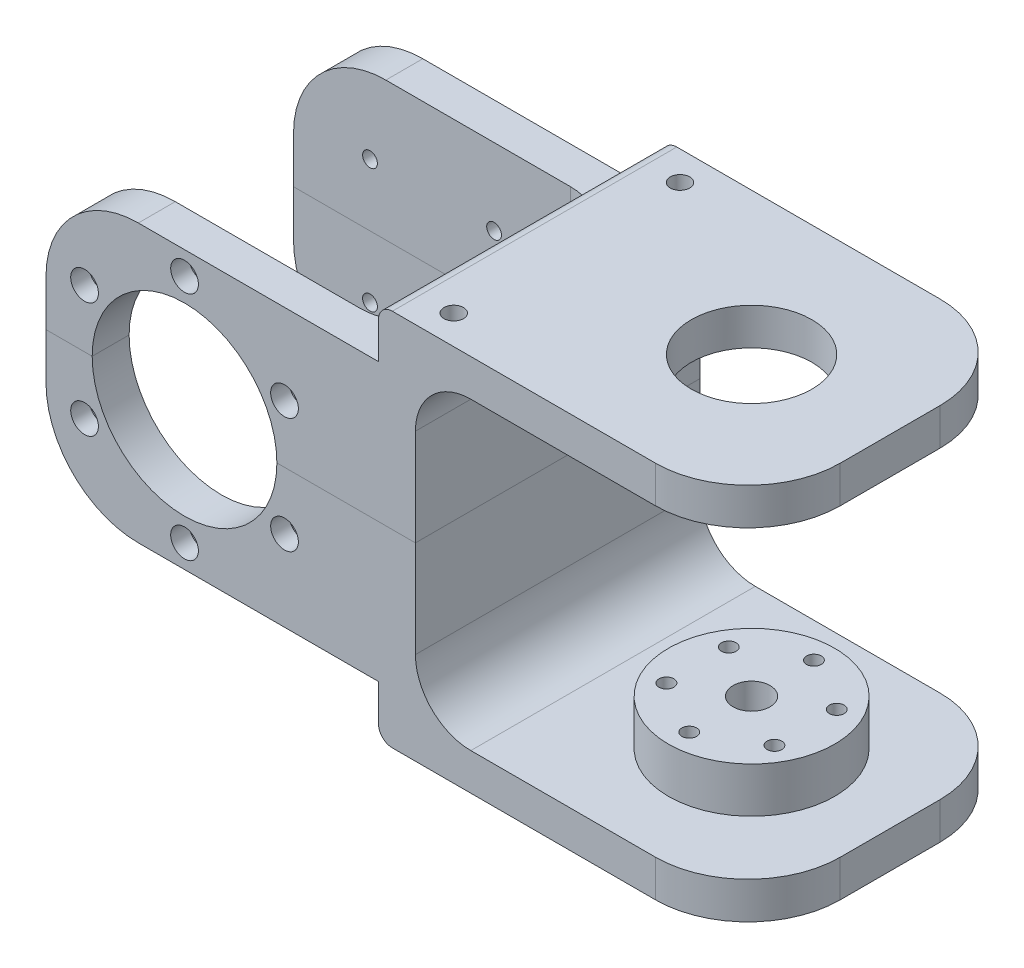
from build123d import *

# Parameters (mm, degrees)
SKETCH_1_W                      = 80
SKETCH_1_H                      = 61.6
EXTRUDE_1_DEPTH                 = 8
SKETCH_2_W                      = 8
SKETCH_2_H                      = 61.6
EXTRUDE_2_DEPTH                 = 52.9
SKETCH_10_W                     = 8
SKETCH_10_H                     = 61.6
EXTRUDE_7_DEPTH                 = 13
SKETCH_11_W                     = 80
SKETCH_11_H                     = 61.6
EXTRUDE_8_DEPTH                 = 8
SKETCH_3_W                      = 8
SKETCH_3_H                      = 60
EXTRUDE_3_DEPTH                 = 72
SKETCH_6_R                      = 18
EXTRUDE_4_DEPTH                 = 9.8
SKETCH_4_R                      = 1.6
SKETCH_4_R_2                    = 4
CUT_EXTRUDE_1_DEPTH             = 138.672982099
CUT_EXTRUDE_1_DIRECTION_2_REACH = 139.673
SKETCH_5_R                      = 1.6
CUT_EXTRUDE_2_DEPTH             = 149.74330237
CUT_EXTRUDE_3_REACH             = 139.673
SKETCH_12_R                     = 13.05
CUT_EXTRUDE_5_REACH             = 153.81
SKETCH_14_R                     = 1.6
SKETCH_14_R_2                   = 20
SKETCH_16_R                     = 8.45
EXTRUDE_9_DEPTH                 = 14.8
FILLET_1_R                      = 12
FILLET_2_R                      = 20
FILLET_3_R                      = 3
CUT_EXTRUDE_START               = -1.6
SKETCH_17_R                     = 8.45
SKETCH_17_R_2                   = 7.45
CUT_EXTRUDE_6_DEPTH             = 1.6
SKETCH_18_R                     = 2.1
CUT_EXTRUDE_7_DEPTH             = 8
SKETCH_19_R                     = 3
CUT_EXTRUDE_8_DEPTH             = 4
SKETCH_20_R                     = 3
CUT_EXTRUDE_9_DEPTH             = 4
SKETCH_21_R                     = 3
CUT_EXTRUDE_10_DEPTH            = 4
SKETCH_22_R                     = 9.5
EXTRUDE_10_DEPTH                = 1


with BuildPart() as part:
    # 草图1 → 凸台-拉伸1 (new body)
    with BuildSketch(Plane(origin=(0, 0, 0), x_dir=(1, 0, 0), z_dir=(0, 1, 0))):
        Rectangle(SKETCH_1_W, SKETCH_1_H)
    extrude(amount=EXTRUDE_1_DEPTH)

    # 草图2 → 凸台-拉伸2 (add)
    with BuildSketch(Plane(origin=(0, 8, 0), x_dir=(1, 0, 0), z_dir=(0, 1, 0))):
        with Locations((-36, 0)):
            Rectangle(SKETCH_2_W, SKETCH_2_H)
    extrude(amount=EXTRUDE_2_DEPTH)

    # 草图10 → 凸台-拉伸7 (add)
    with BuildSketch(Plane(origin=(0, 60.9, 0), x_dir=(1, 0, 0), z_dir=(0, 1, 0))):
        with Locations((-36, 0)):
            Rectangle(SKETCH_10_W, SKETCH_10_H)
    extrude(amount=EXTRUDE_7_DEPTH)

    # 草图11 → 凸台-拉伸8 (add)
    with BuildSketch(Plane(origin=(0, 73.9, 0), x_dir=(1, 0, 0), z_dir=(0, 1, 0))):
        Rectangle(SKETCH_11_W, SKETCH_11_H)
    extrude(amount=EXTRUDE_8_DEPTH)

    # 草图3 → 凸台-拉伸3 (add)
    with BuildSketch(Plane.ZY.offset(40)):
        with Locations((-26.8, 40.95)):
            Rectangle(SKETCH_3_W, SKETCH_3_H)
        with Locations((26.8, 40.95)):
            Rectangle(SKETCH_3_W, SKETCH_3_H)
    extrude(amount=EXTRUDE_3_DEPTH)

    # 草图6 → 凸台-拉伸4 (add)
    with BuildSketch(Plane(origin=(0, 8, 0), x_dir=(1, 0, 0), z_dir=(0, 1, 0))):
        with Locations(Location((10, 0, 0), (0, 0, 270))):
            Circle(SKETCH_6_R)
    extrude(amount=EXTRUDE_4_DEPTH)

    # 草图4 → 切除-拉伸1 (cut)
    with BuildSketch(Plane(origin=(0, 8, 0), x_dir=(1, 0, 0), z_dir=(0, 1, 0))):
        with Locations(Location((10, 13.5, 0), (0, 0, 270))):
            Circle(SKETCH_4_R)
        with Locations(Location((21.691342951, 6.75, 0), (0, 0, 270))):
            Circle(SKETCH_4_R)
        with Locations(Location((21.691342951, -6.75, 0), (0, 0, 270))):
            Circle(SKETCH_4_R)
        with Locations(Location((10, -13.5, 0), (0, 0, 270))):
            Circle(SKETCH_4_R)
        with Locations(Location((-1.691342951, -6.75, 0), (0, 0, 270))):
            Circle(SKETCH_4_R)
        with Locations(Location((-1.691342951, 6.75, 0), (0, 0, 270))):
            Circle(SKETCH_4_R)
        with Locations(Location((10, 0, 0), (0, 0, 270))):
            Circle(SKETCH_4_R_2)
    extrude(amount=-CUT_EXTRUDE_1_DEPTH, mode=Mode.SUBTRACT)

    # 草图4 → 切除-拉伸1 direction 2 (cut, up to next)
    with BuildSketch(Plane(origin=(0, 8, 0), x_dir=(1, 0, 0), z_dir=(0, 1, 0)), mode=Mode.PRIVATE) as cut_extrude_1_direction_2_sk1:
        with Locations(Location((10, 13.5, 0), (0, 0, 270))):
            Circle(SKETCH_4_R)
    cut_extrude_1_direction_2_tool1 = extrude(cut_extrude_1_direction_2_sk1.sketch, amount=CUT_EXTRUDE_1_DIRECTION_2_REACH, mode=Mode.PRIVATE) & part.part
    # 草图4 → 切除-拉伸1 direction 2 (cut, up to next)
    with BuildSketch(Plane(origin=(0, 8, 0), x_dir=(1, 0, 0), z_dir=(0, 1, 0)), mode=Mode.PRIVATE) as cut_extrude_1_direction_2_sk2:
        with Locations(Location((21.691342951, 6.75, 0), (0, 0, 270))):
            Circle(SKETCH_4_R)
    cut_extrude_1_direction_2_tool2 = extrude(cut_extrude_1_direction_2_sk2.sketch, amount=CUT_EXTRUDE_1_DIRECTION_2_REACH, mode=Mode.PRIVATE) & part.part
    # 草图4 → 切除-拉伸1 direction 2 (cut, up to next)
    with BuildSketch(Plane(origin=(0, 8, 0), x_dir=(1, 0, 0), z_dir=(0, 1, 0)), mode=Mode.PRIVATE) as cut_extrude_1_direction_2_sk3:
        with Locations(Location((21.691342951, -6.75, 0), (0, 0, 270))):
            Circle(SKETCH_4_R)
    cut_extrude_1_direction_2_tool3 = extrude(cut_extrude_1_direction_2_sk3.sketch, amount=CUT_EXTRUDE_1_DIRECTION_2_REACH, mode=Mode.PRIVATE) & part.part
    # 草图4 → 切除-拉伸1 direction 2 (cut, up to next)
    with BuildSketch(Plane(origin=(0, 8, 0), x_dir=(1, 0, 0), z_dir=(0, 1, 0)), mode=Mode.PRIVATE) as cut_extrude_1_direction_2_sk4:
        with Locations(Location((10, -13.5, 0), (0, 0, 270))):
            Circle(SKETCH_4_R)
    cut_extrude_1_direction_2_tool4 = extrude(cut_extrude_1_direction_2_sk4.sketch, amount=CUT_EXTRUDE_1_DIRECTION_2_REACH, mode=Mode.PRIVATE) & part.part
    # 草图4 → 切除-拉伸1 direction 2 (cut, up to next)
    with BuildSketch(Plane(origin=(0, 8, 0), x_dir=(1, 0, 0), z_dir=(0, 1, 0)), mode=Mode.PRIVATE) as cut_extrude_1_direction_2_sk5:
        with Locations(Location((-1.691342951, -6.75, 0), (0, 0, 270))):
            Circle(SKETCH_4_R)
    cut_extrude_1_direction_2_tool5 = extrude(cut_extrude_1_direction_2_sk5.sketch, amount=CUT_EXTRUDE_1_DIRECTION_2_REACH, mode=Mode.PRIVATE) & part.part
    # 草图4 → 切除-拉伸1 direction 2 (cut, up to next)
    with BuildSketch(Plane(origin=(0, 8, 0), x_dir=(1, 0, 0), z_dir=(0, 1, 0)), mode=Mode.PRIVATE) as cut_extrude_1_direction_2_sk6:
        with Locations(Location((-1.691342951, 6.75, 0), (0, 0, 270))):
            Circle(SKETCH_4_R)
    cut_extrude_1_direction_2_tool6 = extrude(cut_extrude_1_direction_2_sk6.sketch, amount=CUT_EXTRUDE_1_DIRECTION_2_REACH, mode=Mode.PRIVATE) & part.part
    # 草图4 → 切除-拉伸1 direction 2 (cut, up to next)
    with BuildSketch(Plane(origin=(0, 8, 0), x_dir=(1, 0, 0), z_dir=(0, 1, 0)), mode=Mode.PRIVATE) as cut_extrude_1_direction_2_sk7:
        with Locations(Location((10, 0, 0), (0, 0, 270))):
            Circle(SKETCH_4_R_2)
    cut_extrude_1_direction_2_tool7 = extrude(cut_extrude_1_direction_2_sk7.sketch, amount=CUT_EXTRUDE_1_DIRECTION_2_REACH, mode=Mode.PRIVATE) & part.part
    add(cut_extrude_1_direction_2_tool1.solids().sort_by_distance((10, 8, -13.5))[0], mode=Mode.SUBTRACT)
    add(cut_extrude_1_direction_2_tool2.solids().sort_by_distance((21.691343, 8, -6.75))[0], mode=Mode.SUBTRACT)
    add(cut_extrude_1_direction_2_tool3.solids().sort_by_distance((21.691343, 8, 6.75))[0], mode=Mode.SUBTRACT)
    add(cut_extrude_1_direction_2_tool4.solids().sort_by_distance((10, 8, 13.5))[0], mode=Mode.SUBTRACT)
    add(cut_extrude_1_direction_2_tool5.solids().sort_by_distance((-1.691343, 8, 6.75))[0], mode=Mode.SUBTRACT)
    add(cut_extrude_1_direction_2_tool6.solids().sort_by_distance((-1.691343, 8, -6.75))[0], mode=Mode.SUBTRACT)
    add(cut_extrude_1_direction_2_tool7.solids().sort_by_distance((10, 8, 0))[0], mode=Mode.SUBTRACT)

    # 草图5 → 切除-拉伸2 (cut, through all)
    with BuildSketch(Plane.XY.offset(-22.8)):
        with Locations((-68.564971157, 54.385028843)):
            Circle(SKETCH_5_R)
        with Locations((-68.564971157, 27.514971157)):
            Circle(SKETCH_5_R)
        with Locations((-95.435028843, 27.514971157)):
            Circle(SKETCH_5_R)
        with Locations((-95.435028843, 54.385028843)):
            Circle(SKETCH_5_R)
    extrude(amount=-CUT_EXTRUDE_2_DEPTH, mode=Mode.SUBTRACT)

    # 草图12 → 切除-拉伸3 (cut, up to next)
    with BuildSketch(Plane(origin=(0, 73.9, 0), x_dir=(-1, 0, 0), z_dir=(0, -1, 0)), mode=Mode.PRIVATE) as cut_extrude_3_sk1:
        with Locations(Location((-10, 0, 0), (0, 0, 90))):
            Circle(SKETCH_12_R)
    cut_extrude_3_tool1 = extrude(cut_extrude_3_sk1.sketch, amount=-CUT_EXTRUDE_3_REACH, mode=Mode.PRIVATE) & part.part
    add(cut_extrude_3_tool1.solids().sort_by_distance((10, 73.9, 0))[0], mode=Mode.SUBTRACT)

    # 草图14 → 切除-拉伸5 (cut, up to next)
    with BuildSketch(Plane.XY.offset(30.8), mode=Mode.PRIVATE) as cut_extrude_5_sk1:
        with Locations((-82, 65.95)):
            Circle(SKETCH_14_R)
    cut_extrude_5_tool1 = extrude(cut_extrude_5_sk1.sketch, amount=-CUT_EXTRUDE_5_REACH, mode=Mode.PRIVATE) & part.part
    # 草图14 → 切除-拉伸5 (cut, up to next)
    with BuildSketch(Plane.XY.offset(30.8), mode=Mode.PRIVATE) as cut_extrude_5_sk2:
        with Locations((-60.349364905, 53.45)):
            Circle(SKETCH_14_R)
    cut_extrude_5_tool2 = extrude(cut_extrude_5_sk2.sketch, amount=-CUT_EXTRUDE_5_REACH, mode=Mode.PRIVATE) & part.part
    # 草图14 → 切除-拉伸5 (cut, up to next)
    with BuildSketch(Plane.XY.offset(30.8), mode=Mode.PRIVATE) as cut_extrude_5_sk3:
        with Locations((-60.349364905, 28.45)):
            Circle(SKETCH_14_R)
    cut_extrude_5_tool3 = extrude(cut_extrude_5_sk3.sketch, amount=-CUT_EXTRUDE_5_REACH, mode=Mode.PRIVATE) & part.part
    # 草图14 → 切除-拉伸5 (cut, up to next)
    with BuildSketch(Plane.XY.offset(30.8), mode=Mode.PRIVATE) as cut_extrude_5_sk4:
        with Locations((-82, 15.95)):
            Circle(SKETCH_14_R)
    cut_extrude_5_tool4 = extrude(cut_extrude_5_sk4.sketch, amount=-CUT_EXTRUDE_5_REACH, mode=Mode.PRIVATE) & part.part
    # 草图14 → 切除-拉伸5 (cut, up to next)
    with BuildSketch(Plane.XY.offset(30.8), mode=Mode.PRIVATE) as cut_extrude_5_sk5:
        with Locations((-103.650635095, 28.45)):
            Circle(SKETCH_14_R)
    cut_extrude_5_tool5 = extrude(cut_extrude_5_sk5.sketch, amount=-CUT_EXTRUDE_5_REACH, mode=Mode.PRIVATE) & part.part
    # 草图14 → 切除-拉伸5 (cut, up to next)
    with BuildSketch(Plane.XY.offset(30.8), mode=Mode.PRIVATE) as cut_extrude_5_sk6:
        with Locations((-103.650635095, 53.45)):
            Circle(SKETCH_14_R)
    cut_extrude_5_tool6 = extrude(cut_extrude_5_sk6.sketch, amount=-CUT_EXTRUDE_5_REACH, mode=Mode.PRIVATE) & part.part
    # 草图14 → 切除-拉伸5 (cut, up to next)
    with BuildSketch(Plane.XY.offset(30.8), mode=Mode.PRIVATE) as cut_extrude_5_sk7:
        with Locations((-82, 40.95)):
            Circle(SKETCH_14_R_2)
    cut_extrude_5_tool7 = extrude(cut_extrude_5_sk7.sketch, amount=-CUT_EXTRUDE_5_REACH, mode=Mode.PRIVATE) & part.part
    add(cut_extrude_5_tool1.solids().sort_by_distance((-82, 65.95, 30.8))[0], mode=Mode.SUBTRACT)
    add(cut_extrude_5_tool2.solids().sort_by_distance((-60.349365, 53.45, 30.8))[0], mode=Mode.SUBTRACT)
    add(cut_extrude_5_tool3.solids().sort_by_distance((-60.349365, 28.45, 30.8))[0], mode=Mode.SUBTRACT)
    add(cut_extrude_5_tool4.solids().sort_by_distance((-82, 15.95, 30.8))[0], mode=Mode.SUBTRACT)
    add(cut_extrude_5_tool5.solids().sort_by_distance((-103.650635, 28.45, 30.8))[0], mode=Mode.SUBTRACT)
    add(cut_extrude_5_tool6.solids().sort_by_distance((-103.650635, 53.45, 30.8))[0], mode=Mode.SUBTRACT)
    add(cut_extrude_5_tool7.solids().sort_by_distance((-82, 40.95, 30.8))[0], mode=Mode.SUBTRACT)

    # 草图16 → 凸台-拉伸9 (add)
    with BuildSketch(Plane(origin=(0, 0, -30.8), x_dir=(-1, 0, 0), z_dir=(0, 0, -1))):
        with Locations(Location((82, 40.95, 0), (0, 0, 180))):
            Circle(SKETCH_16_R)
    extrude(amount=EXTRUDE_9_DEPTH)

    # 圆角1
    fillet_1_edges = [part.edges().sort_by_distance(p)[0] for p in [
        (-32, 8, 0),
        (-32, 73.9, 0),
        (-40, 40.95, -22.8),
        (-40, 40.95, 22.8),
    ]]
    fillet(fillet_1_edges, radius=FILLET_1_R)

    # 圆角2
    fillet_2_edges = [part.edges().sort_by_distance(p)[0] for p in [
        (40, 77.9, 30.8),
        (40, 77.9, -30.8),
        (-112, 10.95, -26.8),
        (-112, 70.95, -26.8),
        (-112, 10.95, 26.8),
        (-112, 70.95, 26.8),
        (40, 4, -30.8),
        (40, 4, 30.8),
    ]]
    fillet(fillet_2_edges, radius=FILLET_2_R)

    # 圆角3
    fillet_3_edges = [part.edges().sort_by_distance(p)[0] for p in [
        (-40, 81.9, 0),
        (-40, 0, 0),
    ]]
    fillet(fillet_3_edges, radius=FILLET_3_R)

    # 草图17 → 切除-拉伸6 (cut)
    with BuildSketch(Plane(origin=(0, 0, -43.6), x_dir=(-1, 0, 0), z_dir=(0, 0, -1)).offset(CUT_EXTRUDE_START)):
        with Locations(Location((82, 40.95, 0), (0, 0, 180))):
            Circle(SKETCH_17_R)
        with Locations((82, 40.95)):
            Circle(SKETCH_17_R_2, mode=Mode.SUBTRACT)
    extrude(amount=CUT_EXTRUDE_6_DEPTH, mode=Mode.SUBTRACT)

    # 草图18 → 切除-拉伸7 (cut)
    with BuildSketch(Plane(origin=(0, 81.9, 0), x_dir=(1, 0, 0), z_dir=(0, 1, 0))):
        with Locations(Location((-30, 24.5, 0), (0, 0, 270))):
            Circle(SKETCH_18_R)
        with Locations(Location((-30, -24.5, 0), (0, 0, 270))):
            Circle(SKETCH_18_R)
    extrude(amount=-CUT_EXTRUDE_7_DEPTH, mode=Mode.SUBTRACT)

    # 草图19 → 切除-拉伸8 (cut)
    with BuildSketch(Plane(origin=(0, 0, -30.8), x_dir=(-1, 0, 0), z_dir=(0, 0, -1))):
        with Locations((68.564971157, 27.514971157)):
            Circle(SKETCH_19_R)
        with Locations((68.564971157, 54.385028843)):
            Circle(SKETCH_19_R)
        with Locations((95.435028843, 54.385028843)):
            Circle(SKETCH_19_R)
        with Locations((95.435028843, 27.514971157)):
            Circle(SKETCH_19_R)
    extrude(amount=-CUT_EXTRUDE_8_DEPTH, mode=Mode.SUBTRACT)

    # 草图20 → 切除-拉伸9 (cut)
    with BuildSketch(Plane.XY.offset(30.8)):
        with Locations((-82, 65.95)):
            Circle(SKETCH_20_R)
        with Locations((-60.349364905, 53.45)):
            Circle(SKETCH_20_R)
        with Locations((-60.349364905, 28.45)):
            Circle(SKETCH_20_R)
        with Locations((-82, 15.95)):
            Circle(SKETCH_20_R)
        with Locations((-103.650635095, 28.45)):
            Circle(SKETCH_20_R)
        with Locations((-103.650635095, 53.45)):
            Circle(SKETCH_20_R)
    extrude(amount=-CUT_EXTRUDE_9_DEPTH, mode=Mode.SUBTRACT)

    # 草图21 → 切除-拉伸10 (cut)
    with BuildSketch(Plane(origin=(0, 0, 0), x_dir=(-1, 0, 0), z_dir=(0, -1, 0))):
        with Locations(Location((-10, -13.5, 0), (0, 0, 90))):
            Circle(SKETCH_21_R)
        with Locations(Location((-21.691342951, -6.75, 0), (0, 0, 90))):
            Circle(SKETCH_21_R)
        with Locations(Location((-21.691342951, 6.75, 0), (0, 0, 90))):
            Circle(SKETCH_21_R)
        with Locations(Location((-10, 13.5, 0), (0, 0, 90))):
            Circle(SKETCH_21_R)
        with Locations(Location((1.691342951, 6.75, 0), (0, 0, 90))):
            Circle(SKETCH_21_R)
        with Locations(Location((1.691342951, -6.75, 0), (0, 0, 90))):
            Circle(SKETCH_21_R)
    extrude(amount=-CUT_EXTRUDE_10_DEPTH, mode=Mode.SUBTRACT)

    # 草图22 → 凸台-拉伸10 (add)
    with BuildSketch(Plane(origin=(0, 0, -30.8), x_dir=(-1, 0, 0), z_dir=(0, 0, -1))):
        with Locations(Location((82, 40.95, 0), (0, 0, 180))):
            Circle(SKETCH_22_R)
    extrude(amount=EXTRUDE_10_DEPTH)


with BuildPart() as body_2:
    # Split Bodies 1: the piece on the far side of the plane
    add(part.part)
    split(bisect_by=Plane.ZX.offset(40.95), keep=Keep.BOTTOM)


with BuildPart() as part_1:
    add(part.part)

    # Split Bodies 1
    split(bisect_by=Plane.ZX.offset(40.95), keep=Keep.TOP)


solid = Compound([body_2.part, part_1.part])
